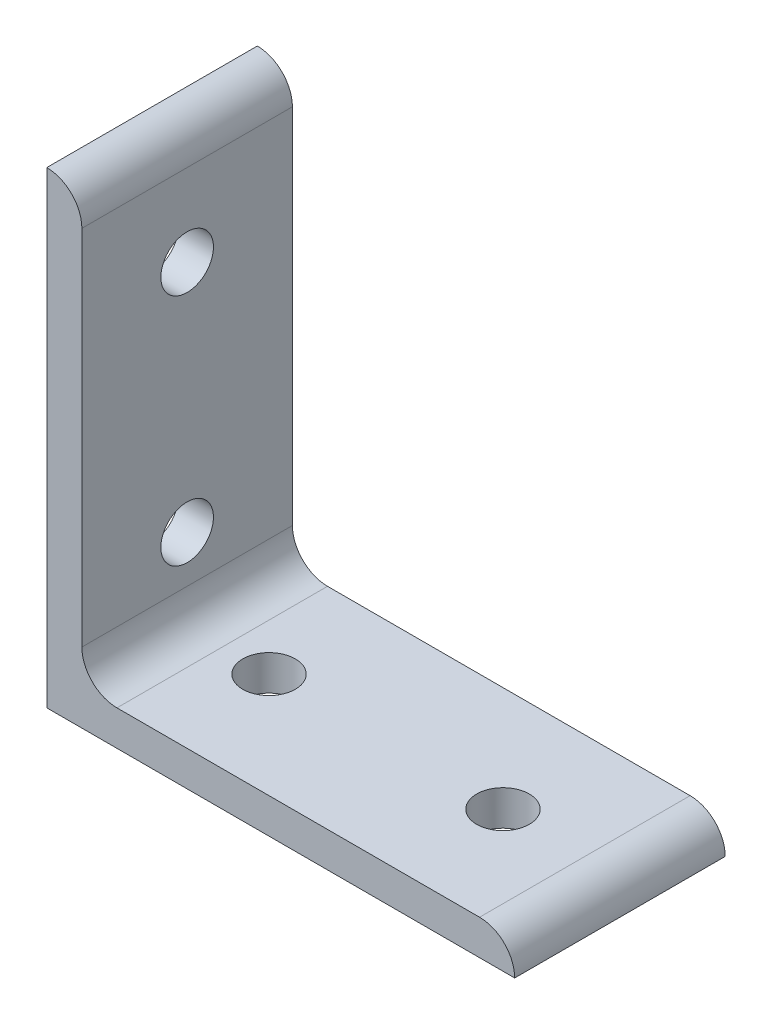
from build123d import *

# Parameters (mm, degrees)
BOSS_EXTRUDE1_DEPTH = 18
SKETCH2_R           = 4.5
CUT_EXTRUDE1_DEPTH  = 115.560027933
SKETCH3_R           = 4.5
CUT_EXTRUDE2_DEPTH  = 115.560027933


with BuildPart() as part:
    # Sketch1 → Boss-Extrude1 (new, symmetric)
    with BuildSketch(Plane.XY):
        with BuildLine():
            Line((0, 0), (0, 80))
            ThreePointArc((0, 80), (4.242640687, 78.242640687), (6, 74))
            Line((6, 74), (6, 12))
            ThreePointArc((6, 12), (7.757359313, 7.757359313), (12, 6))
            Line((12, 6), (74, 6))
            ThreePointArc((74, 6), (78.242640687, 4.242640687), (80, 0))
            Line((80, 0), (0, 0))
        make_face()
    extrude(amount=BOSS_EXTRUDE1_DEPTH, both=True)

    # Sketch2 → Cut-Extrude1 (cut, through all)
    with BuildSketch(Plane(origin=(0, 0, 0), x_dir=(1, 0, 0), z_dir=(0, 1, 0))):
        with Locations((20, 0)):
            Circle(SKETCH2_R)
        with Locations((60, 0)):
            Circle(SKETCH2_R)
    extrude(amount=CUT_EXTRUDE1_DEPTH, mode=Mode.SUBTRACT)

    # Sketch3 → Cut-Extrude2 (cut, through all)
    with BuildSketch(Plane(origin=(0, 0, 0), x_dir=(0, 0, -1), z_dir=(1, 0, 0))):
        with Locations(Location((0, 20, 0), (0, 0, 270))):
            Circle(SKETCH3_R)
        with Locations(Location((0, 60, 0), (0, 0, 270))):
            Circle(SKETCH3_R)
    extrude(amount=CUT_EXTRUDE2_DEPTH, mode=Mode.SUBTRACT)


solid = part.part
